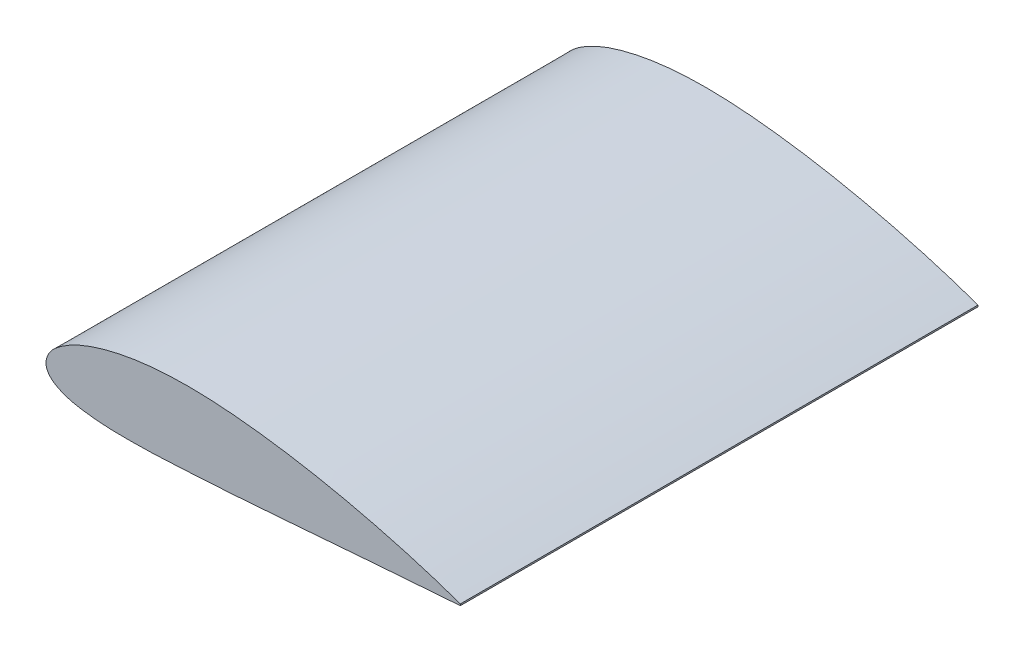
from build123d import *

# Parameters (mm, degrees)
BOSS_EXTRUDE1_DEPTH = 62.5


with BuildPart() as part:
    # Sketch2 → Boss-Extrude1 (new, symmetric)
    with BuildSketch(Plane.XY):
        with BuildLine():
            Line((100, 0.19), (100, -0.19))
            add(Edge.make_bspline(
                [(100, 0.19), (98.336054642, 0.764845915), (95.020893564, 1.910140015), (88.372815363, 3.99119496), (80.050332065, 6.275081208), (70.044588655, 8.613647635), (60.03866438, 10.513538847), (50.031104018, 11.9337906), (40.020344676, 12.82972834), (31.657138298, 12.922716347), (24.983924183, 12.451424688), (19.967967326, 11.778013226), (14.943195689, 10.720815242), (10.765592192, 9.46556819), (7.450393807, 8.077448129), (4.907252579, 6.765624548), (2.785675183, 5.313955872), (0.678587456, 3.334938285), (-0.639700555, 0.412131012), (0.945805466, -2.013404429), (2.81459737, -3.236769208), (4.933879714, -4.117884482), (7.480542813, -4.698670083), (10.817964106, -5.201524685), (14.991871282, -5.559919603), (20.000259285, -5.568030067), (25.002699826, -5.527937612), (31.668165845, -5.170401078), (40.00381152, -4.725051802), (50.003955146, -4.039072774), (60.000038774, -3.237206338), (69.999869087, -2.451783747), (79.997917336, -1.655862379), (88.334360044, -1.063713011), (94.999069588, -0.544106166), (98.333186783, -0.308023805), (100, -0.19)],
                knots=[0, 0, 0, 0, 0.025365089, 0.050536128, 0.10036187, 0.149678338, 0.1985586, 0.247063641, 0.295266786, 0.3432976, 0.367374741, 0.391610789, 0.416159497, 0.441301925, 0.454325483, 0.467881591, 0.482538597, 0.490995278, 0.510026354, 0.521805546, 0.529147847, 0.542208903, 0.554568662, 0.566721378, 0.590824997, 0.614842325, 0.638859653, 0.662900022, 0.711005223, 0.75914609, 0.807321925, 0.855501518, 0.903677353, 0.951838629, 0.975922859, 1, 1, 1, 1], degree=3))
        make_face()
    extrude(amount=BOSS_EXTRUDE1_DEPTH, both=True)


solid = part.part
